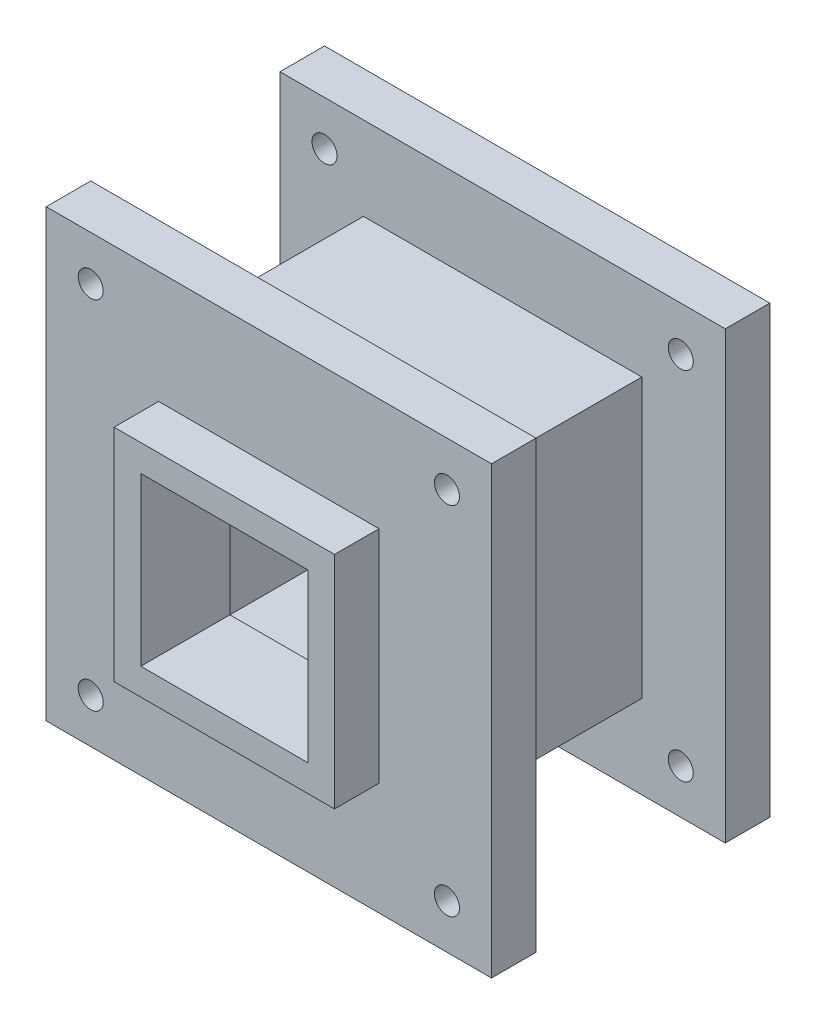
from build123d import *

# Parameters (mm, degrees)
SKETCH_1_W                = 50
SKETCH_1_H                = 50
SKETCH_1_W_2              = 40.4
SKETCH_1_H_2              = 40.4
EXTRUDE_50_4P8_DEPTH      = 50
SKETCH_2_W                = 80
SKETCH_2_H                = 80
SKETCH_2_W_2              = 40.4
SKETCH_2_H_2              = 40.4
EXTRUDE_379_DEPTH         = 8
EXTRUDE_START             = 42
SKETCH_3_W                = 80
SKETCH_3_H                = 80
SKETCH_3_W_2              = 30
SKETCH_3_H_2              = 30
EXTRUDE_483_DEPTH         = 8
EXTRUDE_START_2           = 50
SKETCH_4_W                = 39.6
SKETCH_4_H                = 39.6
SKETCH_4_W_2              = 30
SKETCH_4_H_2              = 30
EXTRUDE_39P6_DEPTH        = 8
CUT_EXTRUDE_M4_DEPTH      = 82.018516402
CUT_EXTRUDE_M4_DEPTH_BACK = 82.018516402
SKETCH_5_R                = 2.25


with BuildPart() as part:
    # 草图1 → 50方管壁厚4p8 (new body)
    with BuildSketch(Plane.XY):
        Rectangle(SKETCH_1_W, SKETCH_1_H)
        Rectangle(SKETCH_1_W_2, SKETCH_1_H_2, mode=Mode.SUBTRACT)
    extrude(amount=EXTRUDE_50_4P8_DEPTH)

    # 草图2 → Extrude 379 (add)
    with BuildSketch(Plane.XY):
        Rectangle(SKETCH_2_W, SKETCH_2_H)
        Rectangle(SKETCH_2_W_2, SKETCH_2_H_2, mode=Mode.SUBTRACT)
    extrude(amount=EXTRUDE_379_DEPTH)

    # 草图3 → Extrude 483 (add)
    with BuildSketch(Plane.XY.offset(EXTRUDE_START)):
        Rectangle(SKETCH_3_W, SKETCH_3_H)
        Rectangle(SKETCH_3_W_2, SKETCH_3_H_2, mode=Mode.SUBTRACT)
    extrude(amount=EXTRUDE_483_DEPTH)

    # 草图4 → 定位凸台39p6 (add)
    with BuildSketch(Plane.XY.offset(EXTRUDE_START_2)):
        Rectangle(SKETCH_4_W, SKETCH_4_H)
        Rectangle(SKETCH_4_W_2, SKETCH_4_H_2, mode=Mode.SUBTRACT)
    extrude(amount=EXTRUDE_39P6_DEPTH)

    # 草图5 → 四个M4法兰通孔 (cut, two sides: drawn at the far end of the back side and taken through both)
    with BuildSketch(Plane.XY.offset(-CUT_EXTRUDE_M4_DEPTH_BACK)):
        with Locations((-32, -32)):
            Circle(SKETCH_5_R)
        with Locations((-32, 32)):
            Circle(SKETCH_5_R)
        with Locations((32, -32)):
            Circle(SKETCH_5_R)
        with Locations((32, 32)):
            Circle(SKETCH_5_R)
    extrude(amount=CUT_EXTRUDE_M4_DEPTH + CUT_EXTRUDE_M4_DEPTH_BACK, mode=Mode.SUBTRACT)


solid = part.part
